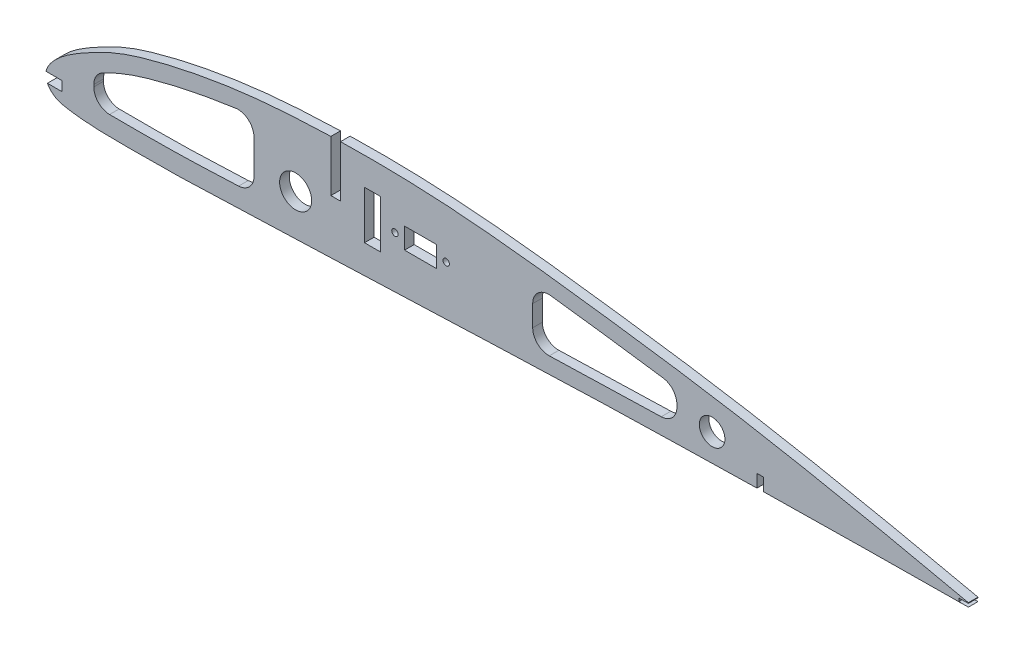
from build123d import *

# Parameters (mm, degrees)
SKETCH_1_R          = 5
SKETCH_1_R_2        = 4
EXTRUDE_1_DEPTH     = 3
SKETCH_3_R          = 1
SKETCH_3_W          = 10
SKETCH_3_H          = 6.5
SKETCH_3_W_2        = 5
SKETCH_3_H_2        = 15
CUT_EXTRUDE_2_DEPTH = 291.422386836


with BuildPart() as part:
    # 草图1 → 凸台-拉伸1 (new body)
    with BuildSketch(Plane.XY):
        with BuildLine():
            Line((90, 12.3715), (90, 28.372426217))
            add(Edge.make_bspline(
                [(90, 28.372426217), (89.259446982, 28.350928743), (82.363996343, 28.13322439), (72.403347361, 27.586524792), (60.185862052, 26.226268085), (51.080991088, 24.79810862), (42.033943524, 23.000087944), (34.581994337, 21.174922903), (28.697351661, 19.44563851), (24.361981086, 17.983441115), (20.174828998, 16.207949367), (16.078941989, 14.139912989), (12.040296713, 11.946766626), (8.14011433, 9.56039573), (5.153679337, 7.316395724), (3.100060439, 5.200618052), (1.813825976, 3.470730924), (1.237398467, 2.180506339), (1.085380705, 1.529058937), (1.078882286, 1.5)],
                knots=[0.345773533, 0.345773533, 0.345773533, 0.345773533, 0.349398211, 0.379527288, 0.394591827, 0.409656366, 0.424720905, 0.439785444, 0.447317713, 0.454849983, 0.462382252, 0.469914522, 0.477446791, 0.484979061, 0.49251133, 0.496277465, 0.5000436, 0.503809734, 0.503985678, 0.503985678, 0.503985678, 0.503985678], degree=3))
            Line((1.078882286, 1.5), (6, 1.5))
            Line((6, 1.5), (6, -1.5))
            Line((6, -1.5), (1.522379628, -1.5))
            add(Edge.make_bspline(
                [(1.522379628, -1.5), (1.617903461, -1.678770523), (2.068186491, -2.42442122), (3.143139608, -3.601090845), (4.854253, -4.619355756), (6.927567017, -5.105597911), (9.209034621, -5.454839075), (12.219971865, -5.84289763), (16.020132359, -6.14266222), (20.609524976, -6.2611368), (25.231457517, -6.286948592), (31.397380169, -6.280305851), (39.107274969, -6.240736398), (48.336813051, -6.022096429), (57.579935967, -5.612990736), (66.840654471, -5.242934226), (76.096556555, -4.921715721), (88.435998513, -4.515955408), (103.853120896, -3.973102953), (122.354625015, -3.248110744), (140.857835973, -2.495489966), (159.368527813, -1.804089638), (177.884173919, -1.222493213), (196.4033921, -0.774877257), (211.439290174, -0.454334834), (220.305576898, -0.265987383), (223, -0.210849605)],
                knots=[0.510182255, 0.510182255, 0.510182255, 0.510182255, 0.511342004, 0.515108139, 0.518874273, 0.522640408, 0.526406543, 0.530172677, 0.537704947, 0.545237216, 0.552769486, 0.560301755, 0.575366294, 0.590430833, 0.605495372, 0.620559911, 0.63562445, 0.650688989, 0.680818067, 0.710947144, 0.741076222, 0.7712053, 0.801334378, 0.831463456, 0.861592533, 0.874744372, 0.874744372, 0.874744372, 0.874744372], degree=3))
            Line((223, -0.210849605), (223, 3.788737263))
            Line((223, 3.788737263), (225, 3.788737263))
            Line((225, 3.788737263), (225, -0.170338801))
            add(Edge.make_bspline(
                [(225, -0.170338801), (227.811595191, -0.114017747), (236.796798206, 0.056910764), (251.961175933, 0.256656825), (270.471854229, 0.429163033), (282.824771355, 0.587434741), (289, 0.610062865)],
                knots=[0.877998396, 0.877998396, 0.877998396, 0.877998396, 0.891721611, 0.921850689, 0.951979767, 0.982108845, 0.982108845, 0.982108845, 0.982108845], degree=3))
            Line((289, 0.610062865), (286, 0.610062865))
            Line((286, 0.610062865), (286, 1.610062865))
            Line((286, 1.610062865), (289, 1.610062865))
            Line((289, 1.610062865), (289, 1.816246039))
            add(Edge.make_bspline(
                [(289, 1.816246039), (276.957314444, 4.502285023), (258.861554155, 8.397620333), (234.648247971, 13.152786595), (216.448478593, 16.478914183), (198.182873559, 19.371550405), (179.850571346, 21.924148488), (161.503162682, 24.358614825), (143.127892269, 26.473190985), (124.712239059, 28.043780086), (107.994173705, 28.616385423), (97.416270032, 28.546670082), (93, 28.44913561)],
                knots=[0.017978355, 0.017978355, 0.017978355, 0.017978355, 0.07823651, 0.108365588, 0.138494666, 0.168623744, 0.198752821, 0.228881899, 0.259010977, 0.289140055, 0.319269133, 0.340879606, 0.340879606, 0.340879606, 0.340879606], degree=3))
            Line((93, 28.44913561), (93, 12.3715))
            Line((93, 12.3715), (90, 12.3715))
        make_face()
        with Locations((79, 8)):
            Circle(SKETCH_1_R, mode=Mode.SUBTRACT)
        with Locations((209, 8)):
            Circle(SKETCH_1_R_2, mode=Mode.SUBTRACT)
    extrude(amount=EXTRUDE_1_DEPTH)

    # 草图3 → 切除-拉伸2 (cut, through all)
    with BuildSketch(Plane.XY):
        with Locations(Location((110, 12.3715, 0), (0, 0, 180))):
            Circle(SKETCH_3_R)
        with Locations(Location((126, 12.3715, 0), (0, 0, 180))):
            Circle(SKETCH_3_R)
        with BuildLine():
            Line((16, 5.402967421), (16, 4.74959002))
            ThreePointArc((16, 4.74959002), (17.438137187, 1.240582567), (20.925253321, -0.249851242))
            add(Edge.make_bspline(
                [(20.925253321, -0.249851242), (22.914045789, -0.279585692), (24.903284625, -0.283778057), (29.14616948, -0.28369414), (31.399982567, -0.278002295), (38.161511328, -0.238823637), (42.669255398, -0.168803371), (51.680216376, 0.117967683), (56.183014764, 0.33147635), (60.85831542, 0.520784363), (61.02954636, 0.527691534), (61.200778311, 0.534573017)],
                knots=[0.014317915, 0.014317915, 0.014317915, 0.014317915, 0.020284927, 0.020284927, 0.027046569, 0.027046569, 0.040569854, 0.040569854, 0.054093138, 0.054093138, 0.054607249, 0.054607249, 0.054607249, 0.054607249], degree=3))
            ThreePointArc((61.200778311, 0.534573017), (64.605821096, 2.066719442), (66, 5.530540197))
            Line((66, 5.530540197), (66, 16.175207171))
            ThreePointArc((66, 16.175207171), (64.287676463, 19.942325894), (60.32352661, 21.129234195))
            add(Edge.make_bspline(
                [(60.32352661, 21.129234195), (59.143282742, 20.968071656), (57.964431768, 20.796736398), (53.109249428, 20.046773379), (49.445857595, 19.384253181), (42.158673028, 17.868714577), (38.533379611, 17.019586343), (33.148990447, 15.546220745), (31.362942012, 15.022439399), (27.821005995, 13.880218625), (26.067238608, 13.253271835), (22.635818059, 11.812670552), (20.957942753, 11.004847704), (19.099592195, 10.049689097), (18.896441621, 9.944700093), (18.693547477, 9.839213217)],
                knots=[0.029920383, 0.029920383, 0.029920383, 0.029920383, 0.033494004, 0.033494004, 0.044658672, 0.044658672, 0.05582334, 0.05582334, 0.061405674, 0.061405674, 0.066988008, 0.066988008, 0.072570342, 0.072570342, 0.073256353, 0.073256353, 0.073256353, 0.073256353], degree=3))
            ThreePointArc((18.693547477, 9.839213217), (16.726110517, 7.997937304), (16, 5.402967421))
        make_face()
        with Locations((118, 12.3715)):
            Rectangle(SKETCH_3_W, SKETCH_3_H)
        with Locations((103, 12.3715)):
            Rectangle(SKETCH_3_W_2, SKETCH_3_H_2)
        with BuildLine():
            Line((153, 14.659796962), (153, 8.136010376))
            ThreePointArc((153, 8.136010376), (154.52636013, 4.539647484), (158.17353042, 3.139022564))
            add(Edge.make_bspline(
                [(158.17353042, 3.139022564), (161.058246521, 3.239200114), (163.943505856, 3.335590583), (171.504636491, 3.576232826), (176.18199895, 3.713351663), (184.945921303, 3.946800138), (189.03214497, 4.046860263), (193.116453453, 4.14201244)],
                knots=[0.711426146, 0.711426146, 0.711426146, 0.711426146, 0.75, 0.75, 0.8125, 0.8125, 0.867133534, 0.867133534, 0.867133534, 0.867133534], degree=3))
            ThreePointArc((193.116453453, 4.14201244), (196.576469437, 5.64653729), (198, 9.140656115))
            Line((198, 9.140656115), (198, 9.967295711))
            ThreePointArc((198, 9.967295711), (196.781019979, 13.238975389), (193.718444833, 14.915410202))
            add(Edge.make_bspline(
                [(193.718444833, 14.915410202), (192.779013077, 15.051811632), (191.839123333, 15.187073825), (186.824226186, 15.902901834), (182.740892869, 16.465870736), (174.565909682, 17.575800313), (170.481299177, 18.120965891), (163.799588722, 18.980812945), (161.201113289, 19.307400191), (158.603501679, 19.623241907)],
                knots=[0.485575284, 0.485575284, 0.485575284, 0.485575284, 0.5, 0.5, 0.5625, 0.5625, 0.625, 0.625, 0.664795718, 0.664795718, 0.664795718, 0.664795718], degree=3))
            ThreePointArc((158.603501679, 19.623241907), (154.684695217, 18.402623995), (153, 14.659796962))
        make_face()
    extrude(amount=CUT_EXTRUDE_2_DEPTH, mode=Mode.SUBTRACT)


solid = part.part
